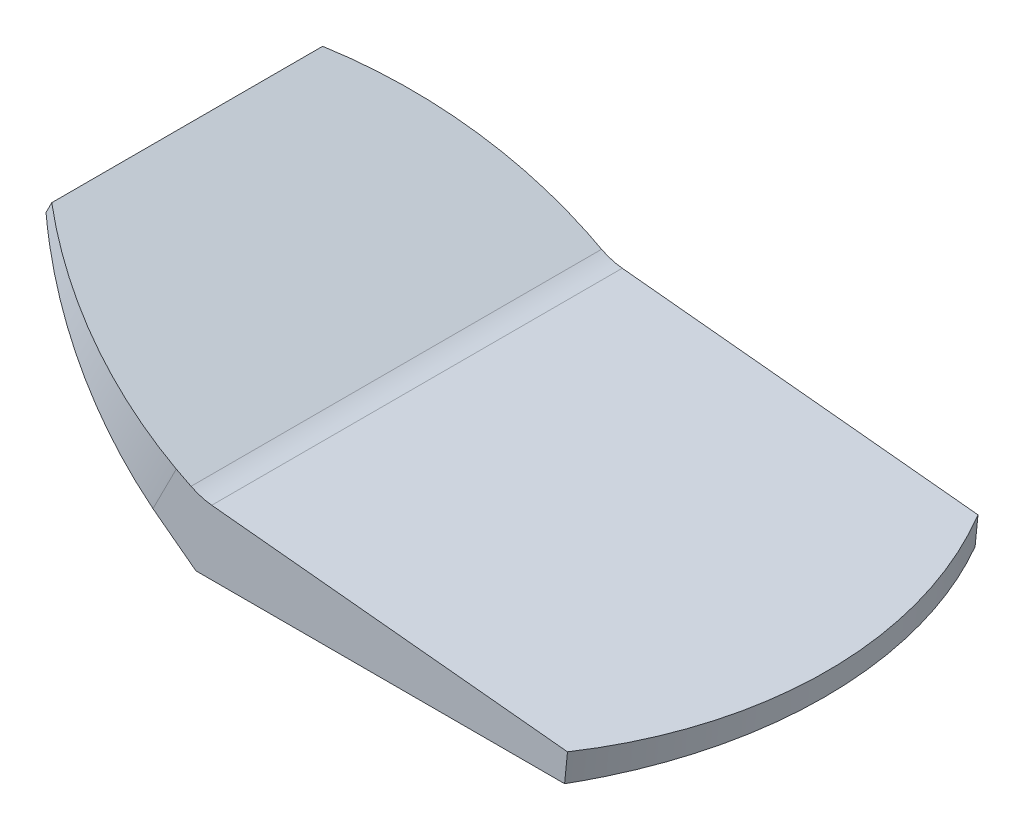
from build123d import *

# Parameters (mm, degrees)
EXTRUDE1_DEPTH = 177.8
EXTRUDE5_DEPTH = 44.45
EXTRUDE6_DEPTH = 44.45


with BuildPart() as part:
    # Sketch1 → Extrude1 (new body)
    with BuildSketch(Plane.XY):
        with BuildLine():
            Line((433.551122257, 624.054848578), (524.118132596, 578.074674098))
            ThreePointArc((524.118132596, 578.074674098), (528.478538405, 576.346602597), (533.082342852, 575.449744447))
            Line((533.082342852, 575.449744447), (710.83449651, 557.626357766))
            Line((710.83449651, 557.626357766), (710.83449651, 547.410087665))
            Line((710.83449651, 547.410087665), (526.236430387, 547.410087665))
            Line((526.236430387, 547.410087665), (431.053198967, 619.134696642))
            Line((431.053198967, 619.134696642), (433.551122257, 624.054848578))
        make_face()
    extrude(amount=-EXTRUDE1_DEPTH)

    # Sketch5 → Extrude5 (cut)
    with BuildSketch(Plane(origin=(62.432960723, 622.642229918, 0), x_dir=(-0.9950104563205879, 0.09977069616222714, 0), z_dir=(0.09977069616222714, 0.9950104563205879, 0))):
        with BuildLine():
            Line((-627.873539531, 0), (-668.145359753, 0))
            Line((-668.145359753, 0), (-668.145359753, -177.8))
            Line((-668.145359753, -177.8), (-627.873539531, -177.8))
            ThreePointArc((-627.873539531, -177.8), (-651.57623812, -88.9), (-627.873539531, 0))
        make_face()
    extrude(amount=-EXTRUDE5_DEPTH, mode=Mode.SUBTRACT)

    # Sketch7 → Extrude6 (cut)
    with BuildSketch(Plane(origin=(340.747990654, 671.170284622, 0), x_dir=(-0.8916667692581813, 0.45269235977723044, 0), z_dir=(0.45269235977723044, 0.8916667692581813, 0))):
        with BuildLine():
            Line((-104.078266458, -30.241656288), (-104.078266458, 0))
            Line((-104.078266458, 0), (-198.470653172, 0))
            ThreePointArc((-198.470653172, 0), (-149.071209803, -8.243889089), (-104.078266458, -30.241656288))
        make_face()
        with BuildLine():
            Line((-104.078266458, -177.8), (-104.078266458, -147.558343712))
            ThreePointArc((-104.078266458, -147.558343712), (-149.071209803, -169.556110911), (-198.470653172, -177.8))
            Line((-198.470653172, -177.8), (-104.078266458, -177.8))
        make_face()
    extrude(amount=-EXTRUDE6_DEPTH, mode=Mode.SUBTRACT)


solid = part.part
